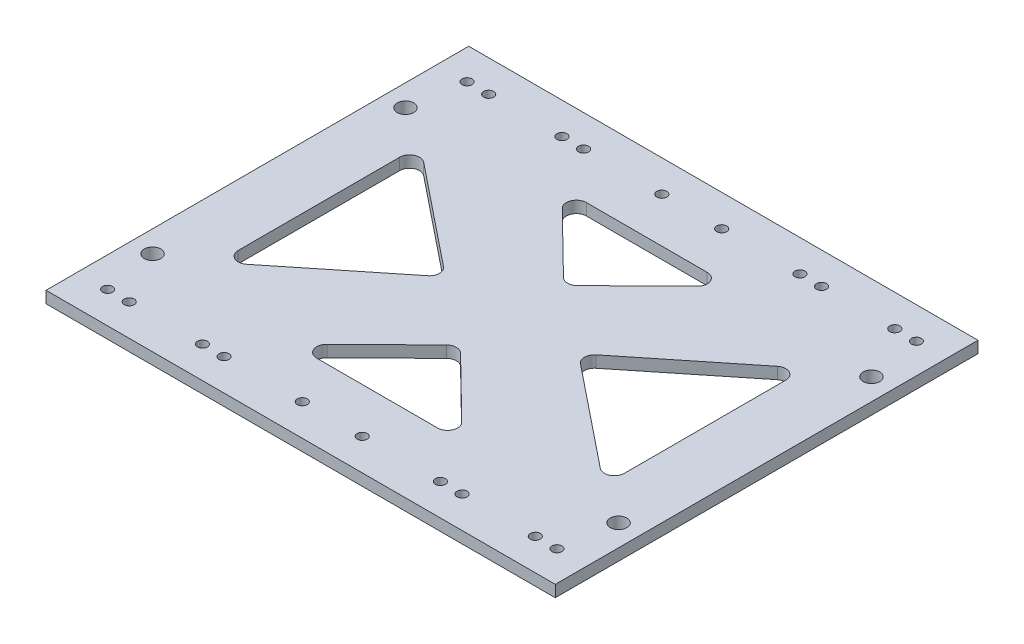
from build123d import *

# Parameters (mm, degrees)
SKETCH1_R                  = 2.5
SKETCH1_R_2                = 1.5
BOSS_EXTRUDE1_DEPTH        = 3.5
MIRROR27_COPY_1_SKETCH_R   = 2.5
MIRROR27_COPY_1_SKETCH_R_2 = 1.5
MIRROR27_COPY_1_DEPTH      = 3.5
FILLET1_R                  = 3
FILLET4_R                  = 3
FILLET5_R                  = 3
FILLET6_R                  = 3


with BuildPart() as part:
    # Sketch1 → Boss-Extrude1 (new body)
    with BuildSketch(Plane(origin=(0, 0, 0), x_dir=(1, 0, 0), z_dir=(0, 1, 0))):
        Polygon((0, -63.5), (18.5, -63.5), (18.5, -33), (56.5, -63.5), (76.5, -63.5), (76.5, -48), (51, -23), (76.5, -23), (76.5, 0), (0, 0), align=None)
        with Locations(Location((6.5, -25.5, 0), (0, 0, 270))):
            Circle(SKETCH1_R, mode=Mode.SUBTRACT)
        with Locations(Location((9, -9.5, 0), (0, 0, 270))):
            Circle(SKETCH1_R_2, mode=Mode.SUBTRACT)
        with Locations(Location((15.5, -9.5, 0), (0, 0, 270))):
            Circle(SKETCH1_R_2, mode=Mode.SUBTRACT)
        with Locations(Location((37.5, -9.5, 0), (0, 0, 270))):
            Circle(SKETCH1_R_2, mode=Mode.SUBTRACT)
        with Locations(Location((44, -9.5, 0), (0, 0, 270))):
            Circle(SKETCH1_R_2, mode=Mode.SUBTRACT)
        with Locations(Location((67.5, -9.5, 0), (0, 0, 270))):
            Circle(SKETCH1_R_2, mode=Mode.SUBTRACT)
    boss_extrude1 = extrude(amount=BOSS_EXTRUDE1_DEPTH)

    # Mirror1: Boss-Extrude1 across plane
    add(boss_extrude1.mirror(Plane(origin=(0, 3.5, 63.5), x_dir=(1, 0, 0), z_dir=(0, 0, -1))))

    # Mirror26: Boss-Extrude1 across plane
    add(boss_extrude1.mirror(Plane(origin=(76.5, 3.5, 0), x_dir=(0, 0, 1), z_dir=(1, 0, 0))))

    # Mirror27: Boss-Extrude1 across plane
    add(boss_extrude1.mirror(Plane(origin=(153, 3.5, 63.5), x_dir=(1, 0, 0), z_dir=(0, 0, 1))))

    # Mirror27 copy 1 sketch → Mirror27 copy 1 (add)
    with BuildSketch(Plane(origin=(153, 0, 127), x_dir=(-1, 0, 0), z_dir=(0, 1, 0))):
        Polygon((0, -63.5), (18.5, -63.5), (18.5, -33), (56.5, -63.5), (76.5, -63.5), (76.5, -48), (51, -23), (76.5, -23), (76.5, 0), (0, 0), align=None)
        with Locations(Location((6.5, -25.5, 0), (0, 0, 270))):
            Circle(MIRROR27_COPY_1_SKETCH_R, mode=Mode.SUBTRACT)
        with Locations(Location((9, -9.5, 0), (0, 0, 270))):
            Circle(MIRROR27_COPY_1_SKETCH_R_2, mode=Mode.SUBTRACT)
        with Locations(Location((15.5, -9.5, 0), (0, 0, 270))):
            Circle(MIRROR27_COPY_1_SKETCH_R_2, mode=Mode.SUBTRACT)
        with Locations(Location((37.5, -9.5, 0), (0, 0, 270))):
            Circle(MIRROR27_COPY_1_SKETCH_R_2, mode=Mode.SUBTRACT)
        with Locations(Location((44, -9.5, 0), (0, 0, 270))):
            Circle(MIRROR27_COPY_1_SKETCH_R_2, mode=Mode.SUBTRACT)
        with Locations(Location((67.5, -9.5, 0), (0, 0, 270))):
            Circle(MIRROR27_COPY_1_SKETCH_R_2, mode=Mode.SUBTRACT)
    extrude(amount=MIRROR27_COPY_1_DEPTH)

    # Fillet1
    fillet1_edges = [part.edges().sort_by_distance(p)[0] for p in [
        (56.5, 1.75, 63.5),
        (18.5, 1.75, 33),
        (18.5, 1.75, 94),
    ]]
    fillet(fillet1_edges, radius=FILLET1_R)

    # Fillet4
    fillet4_edges = [part.edges().sort_by_distance(p)[0] for p in [
        (76.5, 1.75, 48),
        (51, 1.75, 23),
        (102, 1.75, 23),
    ]]
    fillet(fillet4_edges, radius=FILLET4_R)

    # Fillet5
    fillet5_edges = [part.edges().sort_by_distance(p)[0] for p in [
        (134.5, 1.75, 94),
        (96.5, 1.75, 63.5),
        (134.5, 1.75, 33),
    ]]
    fillet(fillet5_edges, radius=FILLET5_R)

    # Fillet6
    fillet6_edges = [part.edges().sort_by_distance(p)[0] for p in [
        (102, 1.75, 104),
        (51, 1.75, 104),
        (76.5, 1.75, 79),
    ]]
    fillet(fillet6_edges, radius=FILLET6_R)


solid = part.part
